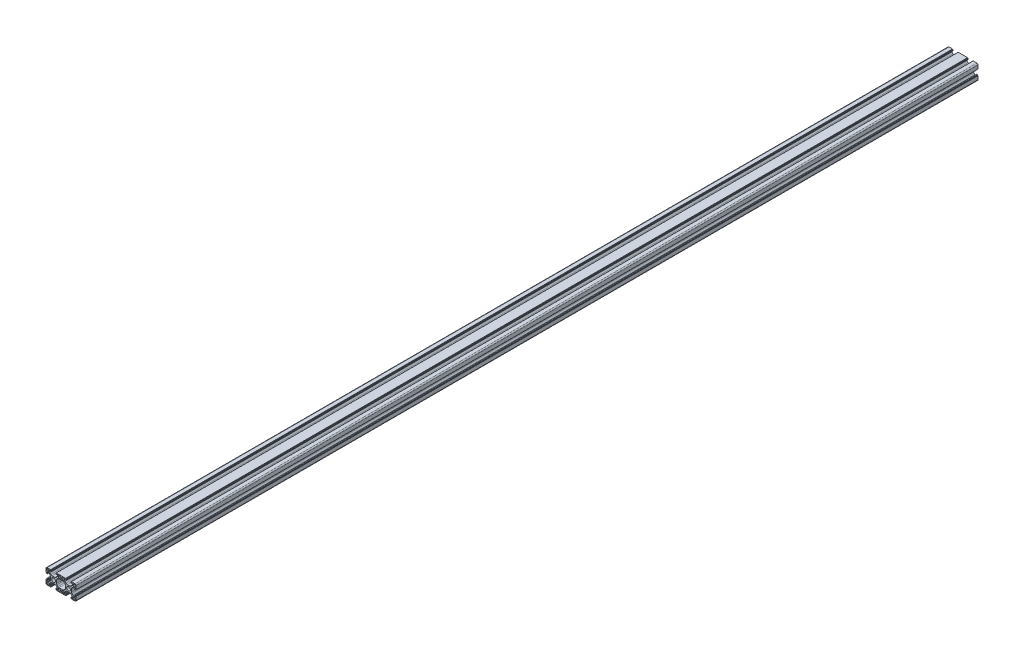
from build123d import *

# Parameters (mm, degrees)
EXTRUDE_1_DEPTH = 1200


with BuildPart() as part:
    # Эскиз2 → Бобышка-Вытянуть1 (new body)
    with BuildSketch(Plane.XY):
        with BuildLine():
            Line((9.107127774, 4.555592697), (11.005908444, 4.555592697))
            ThreePointArc((11.005908444, 4.555592697), (11.771275308, 4.707833632), (12.420122006, 5.141379135))
            Line((12.420122006, 5.141379135), (13.721341337, 6.442598466))
            ThreePointArc((13.721341337, 6.442598466), (14.15488684, 7.091445164), (14.307127774, 7.856812028))
            Line((14.307127774, 7.856812028), (14.307127774, 8.755592697))
            ThreePointArc((14.307127774, 8.755592697), (14.160681165, 9.109146088), (13.807127774, 9.255592697))
            Line((13.807127774, 9.255592697), (13.704234556, 9.255592697))
            ThreePointArc((13.704234556, 9.255592697), (13.51289284, 9.217532464), (13.350681165, 9.109146088))
            Line((13.350681165, 9.109146088), (12.870351079, 8.628816002))
            ThreePointArc((12.870351079, 8.628816002), (12.789245242, 8.574622814), (12.693574384, 8.555592697))
            Line((12.693574384, 8.555592697), (12.407127774, 8.555592697))
            ThreePointArc((12.407127774, 8.555592697), (12.230351079, 8.628816002), (12.157127774, 8.805592697))
            Line((12.157127774, 8.805592697), (12.157127774, 9.954663518))
            ThreePointArc((12.157127774, 9.954663518), (12.201061757, 10.060729535), (12.307127774, 10.104663518))
            Line((12.307127774, 10.104663518), (12.807127774, 10.104663518))
            Line((12.807127774, 10.104663518), (12.807127774, 10.405592697))
            ThreePointArc((12.807127774, 10.405592697), (12.851061757, 10.511658715), (12.957127774, 10.555592697))
            Line((12.957127774, 10.555592697), (17.607127774, 10.555592697))
            ThreePointArc((17.607127774, 10.555592697), (18.667787946, 10.116252869), (19.107127774, 9.055592697))
            Line((19.107127774, 9.055592697), (19.107127774, 4.405592697))
            ThreePointArc((19.107127774, 4.405592697), (19.063193792, 4.29952668), (18.957127774, 4.255592697))
            Line((18.957127774, 4.255592697), (18.656198595, 4.255592697))
            Line((18.656198595, 4.255592697), (18.656198595, 3.755592697))
            ThreePointArc((18.656198595, 3.755592697), (18.612264612, 3.64952668), (18.506198595, 3.605592697))
            Line((18.506198595, 3.605592697), (17.357127774, 3.605592697))
            ThreePointArc((17.357127774, 3.605592697), (17.180351079, 3.678816002), (17.107127774, 3.855592697))
            Line((17.107127774, 3.855592697), (17.107127774, 4.142039307))
            ThreePointArc((17.107127774, 4.142039307), (17.126157891, 4.237710165), (17.180351079, 4.318816002))
            Line((17.180351079, 4.318816002), (17.660681165, 4.799146088))
            ThreePointArc((17.660681165, 4.799146088), (17.769067541, 4.961357762), (17.807127774, 5.152699479))
            Line((17.807127774, 5.152699479), (17.807127774, 5.255592697))
            ThreePointArc((17.807127774, 5.255592697), (17.660681165, 5.609146088), (17.307127774, 5.755592697))
            Line((17.307127774, 5.755592697), (16.408347105, 5.755592697))
            ThreePointArc((16.408347105, 5.755592697), (15.642980241, 5.603351762), (14.994133543, 5.16980626))
            Line((14.994133543, 5.16980626), (13.692914212, 3.868586929))
            ThreePointArc((13.692914212, 3.868586929), (13.259368709, 3.219740231), (13.107127774, 2.454373367))
            Line((13.107127774, 2.454373367), (13.107127774, 0.555592697))
            Line((13.107127774, 0.555592697), (13.107127774, -1.343187972))
            ThreePointArc((13.107127774, -1.343187972), (13.259368709, -2.108554836), (13.692914212, -2.757401534))
            Line((13.692914212, -2.757401534), (14.994133543, -4.058620865))
            ThreePointArc((14.994133543, -4.058620865), (15.642980241, -4.492166368), (16.408347105, -4.644407303))
            Line((16.408347105, -4.644407303), (17.307127774, -4.644407303))
            ThreePointArc((17.307127774, -4.644407303), (17.660681165, -4.497960693), (17.807127774, -4.144407303))
            Line((17.807127774, -4.144407303), (17.807127774, -4.041514084))
            ThreePointArc((17.807127774, -4.041514084), (17.769067541, -3.850172368), (17.660681165, -3.687960693))
            Line((17.660681165, -3.687960693), (17.180351079, -3.207630607))
            ThreePointArc((17.180351079, -3.207630607), (17.126157891, -3.12652477), (17.107127774, -3.030853912))
            Line((17.107127774, -3.030853912), (17.107127774, -2.744407303))
            ThreePointArc((17.107127774, -2.744407303), (17.180351079, -2.567630607), (17.357127774, -2.494407303))
            Line((17.357127774, -2.494407303), (18.506198595, -2.494407303))
            ThreePointArc((18.506198595, -2.494407303), (18.612264612, -2.538341285), (18.656198595, -2.644407303))
            Line((18.656198595, -2.644407303), (18.656198595, -3.144407303))
            Line((18.656198595, -3.144407303), (18.957127774, -3.144407303))
            ThreePointArc((18.957127774, -3.144407303), (19.063193792, -3.188341285), (19.107127774, -3.294407303))
            Line((19.107127774, -3.294407303), (19.107127774, -7.944407303))
            ThreePointArc((19.107127774, -7.944407303), (18.667787946, -9.005067474), (17.607127774, -9.444407303))
            Line((17.607127774, -9.444407303), (12.957127774, -9.444407303))
            ThreePointArc((12.957127774, -9.444407303), (12.851061757, -9.40047332), (12.807127774, -9.294407303))
            Line((12.807127774, -9.294407303), (12.807127774, -8.993478123))
            Line((12.807127774, -8.993478123), (12.307127774, -8.993478123))
            ThreePointArc((12.307127774, -8.993478123), (12.201061757, -8.94954414), (12.157127774, -8.843478123))
            Line((12.157127774, -8.843478123), (12.157127774, -7.694407303))
            ThreePointArc((12.157127774, -7.694407303), (12.230351079, -7.517630607), (12.407127774, -7.444407303))
            Line((12.407127774, -7.444407303), (12.693574384, -7.444407303))
            ThreePointArc((12.693574384, -7.444407303), (12.789245242, -7.463437419), (12.870351079, -7.517630607))
            Line((12.870351079, -7.517630607), (13.350681165, -7.997960693))
            ThreePointArc((13.350681165, -7.997960693), (13.51289284, -8.106347069), (13.704234556, -8.144407303))
            Line((13.704234556, -8.144407303), (13.807127774, -8.144407303))
            ThreePointArc((13.807127774, -8.144407303), (14.160681165, -7.997960693), (14.307127774, -7.644407303))
            Line((14.307127774, -7.644407303), (14.307127774, -6.745626633))
            ThreePointArc((14.307127774, -6.745626633), (14.15488684, -5.980259769), (13.721341337, -5.331413071))
            Line((13.721341337, -5.331413071), (12.420122006, -4.03019374))
            ThreePointArc((12.420122006, -4.03019374), (11.771275308, -3.596648238), (11.005908444, -3.444407303))
            Line((11.005908444, -3.444407303), (9.107127774, -3.444407303))
            Line((9.107127774, -3.444407303), (7.208347105, -3.444407303))
            ThreePointArc((7.208347105, -3.444407303), (6.442980241, -3.596648238), (5.794133543, -4.03019374))
            Line((5.794133543, -4.03019374), (4.492914212, -5.331413071))
            ThreePointArc((4.492914212, -5.331413071), (4.059368709, -5.980259769), (3.907127774, -6.745626633))
            Line((3.907127774, -6.745626633), (3.907127774, -7.644407303))
            ThreePointArc((3.907127774, -7.644407303), (4.053574384, -7.997960693), (4.407127774, -8.144407303))
            Line((4.407127774, -8.144407303), (4.510020993, -8.144407303))
            ThreePointArc((4.510020993, -8.144407303), (4.701362709, -8.106347069), (4.863574384, -7.997960693))
            Line((4.863574384, -7.997960693), (5.34390447, -7.517630607))
            ThreePointArc((5.34390447, -7.517630607), (5.425010307, -7.463437419), (5.520681165, -7.444407303))
            Line((5.520681165, -7.444407303), (5.807127774, -7.444407303))
            ThreePointArc((5.807127774, -7.444407303), (5.98390447, -7.517630607), (6.057127774, -7.694407303))
            Line((6.057127774, -7.694407303), (6.057127774, -8.843478123))
            ThreePointArc((6.057127774, -8.843478123), (6.013193792, -8.94954414), (5.907127774, -8.993478123))
            Line((5.907127774, -8.993478123), (5.407127774, -8.993478123))
            Line((5.407127774, -8.993478123), (5.407127774, -9.294407303))
            ThreePointArc((5.407127774, -9.294407303), (5.363193792, -9.40047332), (5.257127774, -9.444407303))
            Line((5.257127774, -9.444407303), (0.607127774, -9.444407303))
            Line((0.607127774, -9.444407303), (-2.392872226, -9.444407303))
            Line((-2.392872226, -9.444407303), (-7.042872226, -9.444407303))
            ThreePointArc((-7.042872226, -9.444407303), (-7.148938243, -9.40047332), (-7.192872226, -9.294407303))
            Line((-7.192872226, -9.294407303), (-7.192872226, -8.993478123))
            Line((-7.192872226, -8.993478123), (-7.692872226, -8.993478123))
            ThreePointArc((-7.692872226, -8.993478123), (-7.798938243, -8.94954414), (-7.842872226, -8.843478123))
            Line((-7.842872226, -8.843478123), (-7.842872226, -7.694407303))
            ThreePointArc((-7.842872226, -7.694407303), (-7.769648921, -7.517630607), (-7.592872226, -7.444407303))
            Line((-7.592872226, -7.444407303), (-7.306425616, -7.444407303))
            ThreePointArc((-7.306425616, -7.444407303), (-7.210754758, -7.463437419), (-7.129648921, -7.517630607))
            Line((-7.129648921, -7.517630607), (-6.649318835, -7.997960693))
            ThreePointArc((-6.649318835, -7.997960693), (-6.48710716, -8.106347069), (-6.295765444, -8.144407303))
            Line((-6.295765444, -8.144407303), (-6.192872226, -8.144407303))
            ThreePointArc((-6.192872226, -8.144407303), (-5.839318835, -7.997960693), (-5.692872226, -7.644407303))
            Line((-5.692872226, -7.644407303), (-5.692872226, -6.745626633))
            ThreePointArc((-5.692872226, -6.745626633), (-5.84511316, -5.980259769), (-6.278658663, -5.331413071))
            Line((-6.278658663, -5.331413071), (-7.579877994, -4.03019374))
            ThreePointArc((-7.579877994, -4.03019374), (-8.228724692, -3.596648238), (-8.994091556, -3.444407303))
            Line((-8.994091556, -3.444407303), (-10.892872226, -3.444407303))
            Line((-10.892872226, -3.444407303), (-12.791652895, -3.444407303))
            ThreePointArc((-12.791652895, -3.444407303), (-13.557019759, -3.596648238), (-14.205866457, -4.03019374))
            Line((-14.205866457, -4.03019374), (-15.507085788, -5.331413071))
            ThreePointArc((-15.507085788, -5.331413071), (-15.940631291, -5.980259769), (-16.092872226, -6.745626633))
            Line((-16.092872226, -6.745626633), (-16.092872226, -7.644407303))
            ThreePointArc((-16.092872226, -7.644407303), (-15.946425616, -7.997960693), (-15.592872226, -8.144407303))
            Line((-15.592872226, -8.144407303), (-15.489979007, -8.144407303))
            ThreePointArc((-15.489979007, -8.144407303), (-15.298637291, -8.106347069), (-15.136425616, -7.997960693))
            Line((-15.136425616, -7.997960693), (-14.65609553, -7.517630607))
            ThreePointArc((-14.65609553, -7.517630607), (-14.574989693, -7.463437419), (-14.479318835, -7.444407303))
            Line((-14.479318835, -7.444407303), (-14.192872226, -7.444407303))
            ThreePointArc((-14.192872226, -7.444407303), (-14.01609553, -7.517630607), (-13.942872226, -7.694407303))
            Line((-13.942872226, -7.694407303), (-13.942872226, -8.843478123))
            ThreePointArc((-13.942872226, -8.843478123), (-13.986806208, -8.94954414), (-14.092872226, -8.993478123))
            Line((-14.092872226, -8.993478123), (-14.592872226, -8.993478123))
            Line((-14.592872226, -8.993478123), (-14.592872226, -9.294407303))
            ThreePointArc((-14.592872226, -9.294407303), (-14.636806208, -9.40047332), (-14.742872226, -9.444407303))
            Line((-14.742872226, -9.444407303), (-19.392872226, -9.444407303))
            ThreePointArc((-19.392872226, -9.444407303), (-20.453532397, -9.005067474), (-20.892872226, -7.944407303))
            Line((-20.892872226, -7.944407303), (-20.892872226, -3.294407303))
            ThreePointArc((-20.892872226, -3.294407303), (-20.848938243, -3.188341285), (-20.742872226, -3.144407303))
            Line((-20.742872226, -3.144407303), (-20.441943046, -3.144407303))
            Line((-20.441943046, -3.144407303), (-20.441943046, -2.644407303))
            ThreePointArc((-20.441943046, -2.644407303), (-20.398009063, -2.538341285), (-20.291943046, -2.494407303))
            Line((-20.291943046, -2.494407303), (-19.142872226, -2.494407303))
            ThreePointArc((-19.142872226, -2.494407303), (-18.96609553, -2.567630607), (-18.892872226, -2.744407303))
            Line((-18.892872226, -2.744407303), (-18.892872226, -3.030853912))
            ThreePointArc((-18.892872226, -3.030853912), (-18.911902342, -3.12652477), (-18.96609553, -3.207630607))
            Line((-18.96609553, -3.207630607), (-19.446425616, -3.687960693))
            ThreePointArc((-19.446425616, -3.687960693), (-19.554811992, -3.850172368), (-19.592872226, -4.041514084))
            Line((-19.592872226, -4.041514084), (-19.592872226, -4.144407303))
            ThreePointArc((-19.592872226, -4.144407303), (-19.446425616, -4.497960693), (-19.092872226, -4.644407303))
            Line((-19.092872226, -4.644407303), (-18.194091556, -4.644407303))
            ThreePointArc((-18.194091556, -4.644407303), (-17.428724692, -4.492166368), (-16.779877994, -4.058620865))
            Line((-16.779877994, -4.058620865), (-15.478658663, -2.757401534))
            ThreePointArc((-15.478658663, -2.757401534), (-15.04511316, -2.108554836), (-14.892872226, -1.343187972))
            Line((-14.892872226, -1.343187972), (-14.892872226, 0.555592697))
            Line((-14.892872226, 0.555592697), (-14.892872226, 2.454373367))
            ThreePointArc((-14.892872226, 2.454373367), (-15.04511316, 3.219740231), (-15.478658663, 3.868586929))
            Line((-15.478658663, 3.868586929), (-16.779877994, 5.16980626))
            ThreePointArc((-16.779877994, 5.16980626), (-17.428724692, 5.603351762), (-18.194091556, 5.755592697))
            Line((-18.194091556, 5.755592697), (-19.092872226, 5.755592697))
            ThreePointArc((-19.092872226, 5.755592697), (-19.446425616, 5.609146088), (-19.592872226, 5.255592697))
            Line((-19.592872226, 5.255592697), (-19.592872226, 5.152699479))
            ThreePointArc((-19.592872226, 5.152699479), (-19.554811992, 4.961357762), (-19.446425616, 4.799146088))
            Line((-19.446425616, 4.799146088), (-18.96609553, 4.318816002))
            ThreePointArc((-18.96609553, 4.318816002), (-18.911902342, 4.237710165), (-18.892872226, 4.142039307))
            Line((-18.892872226, 4.142039307), (-18.892872226, 3.855592697))
            ThreePointArc((-18.892872226, 3.855592697), (-18.96609553, 3.678816002), (-19.142872226, 3.605592697))
            Line((-19.142872226, 3.605592697), (-20.291943046, 3.605592697))
            ThreePointArc((-20.291943046, 3.605592697), (-20.398009063, 3.64952668), (-20.441943046, 3.755592697))
            Line((-20.441943046, 3.755592697), (-20.441943046, 4.255592697))
            Line((-20.441943046, 4.255592697), (-20.742872226, 4.255592697))
            ThreePointArc((-20.742872226, 4.255592697), (-20.848938243, 4.29952668), (-20.892872226, 4.405592697))
            Line((-20.892872226, 4.405592697), (-20.892872226, 9.055592697))
            ThreePointArc((-20.892872226, 9.055592697), (-20.453532397, 10.116252869), (-19.392872226, 10.555592697))
            Line((-19.392872226, 10.555592697), (-14.742872226, 10.555592697))
            ThreePointArc((-14.742872226, 10.555592697), (-14.636806208, 10.511658715), (-14.592872226, 10.405592697))
            Line((-14.592872226, 10.405592697), (-14.592872226, 10.104663518))
            Line((-14.592872226, 10.104663518), (-14.092872226, 10.104663518))
            ThreePointArc((-14.092872226, 10.104663518), (-13.986806208, 10.060729535), (-13.942872226, 9.954663518))
            Line((-13.942872226, 9.954663518), (-13.942872226, 8.805592697))
            ThreePointArc((-13.942872226, 8.805592697), (-14.01609553, 8.628816002), (-14.192872226, 8.555592697))
            Line((-14.192872226, 8.555592697), (-14.479318835, 8.555592697))
            ThreePointArc((-14.479318835, 8.555592697), (-14.574989693, 8.574622814), (-14.65609553, 8.628816002))
            Line((-14.65609553, 8.628816002), (-15.136425616, 9.109146088))
            ThreePointArc((-15.136425616, 9.109146088), (-15.298637291, 9.217532464), (-15.489979007, 9.255592697))
            Line((-15.489979007, 9.255592697), (-15.592872226, 9.255592697))
            ThreePointArc((-15.592872226, 9.255592697), (-15.946425616, 9.109146088), (-16.092872226, 8.755592697))
            Line((-16.092872226, 8.755592697), (-16.092872226, 7.856812028))
            ThreePointArc((-16.092872226, 7.856812028), (-15.940631291, 7.091445164), (-15.507085788, 6.442598466))
            Line((-15.507085788, 6.442598466), (-14.205866457, 5.141379135))
            ThreePointArc((-14.205866457, 5.141379135), (-13.557019759, 4.707833632), (-12.791652895, 4.555592697))
            Line((-12.791652895, 4.555592697), (-10.892872226, 4.555592697))
            Line((-10.892872226, 4.555592697), (-8.994091556, 4.555592697))
            ThreePointArc((-8.994091556, 4.555592697), (-8.228724692, 4.707833632), (-7.579877994, 5.141379135))
            Line((-7.579877994, 5.141379135), (-6.278658663, 6.442598466))
            ThreePointArc((-6.278658663, 6.442598466), (-5.84511316, 7.091445164), (-5.692872226, 7.856812028))
            Line((-5.692872226, 7.856812028), (-5.692872226, 8.755592697))
            ThreePointArc((-5.692872226, 8.755592697), (-5.839318835, 9.109146088), (-6.192872226, 9.255592697))
            Line((-6.192872226, 9.255592697), (-6.295765444, 9.255592697))
            ThreePointArc((-6.295765444, 9.255592697), (-6.48710716, 9.217532464), (-6.649318835, 9.109146088))
            Line((-6.649318835, 9.109146088), (-7.129648921, 8.628816002))
            ThreePointArc((-7.129648921, 8.628816002), (-7.210754758, 8.574622814), (-7.306425616, 8.555592697))
            Line((-7.306425616, 8.555592697), (-7.592872226, 8.555592697))
            ThreePointArc((-7.592872226, 8.555592697), (-7.769648921, 8.628816002), (-7.842872226, 8.805592697))
            Line((-7.842872226, 8.805592697), (-7.842872226, 9.954663518))
            ThreePointArc((-7.842872226, 9.954663518), (-7.798938243, 10.060729535), (-7.692872226, 10.104663518))
            Line((-7.692872226, 10.104663518), (-7.192872226, 10.104663518))
            Line((-7.192872226, 10.104663518), (-7.192872226, 10.405592697))
            ThreePointArc((-7.192872226, 10.405592697), (-7.148938243, 10.511658715), (-7.042872226, 10.555592697))
            Line((-7.042872226, 10.555592697), (-2.392872226, 10.555592697))
            Line((-2.392872226, 10.555592697), (0.607127774, 10.555592697))
            Line((0.607127774, 10.555592697), (5.257127774, 10.555592697))
            ThreePointArc((5.257127774, 10.555592697), (5.363193792, 10.511658715), (5.407127774, 10.405592697))
            Line((5.407127774, 10.405592697), (5.407127774, 10.104663518))
            Line((5.407127774, 10.104663518), (5.907127774, 10.104663518))
            ThreePointArc((5.907127774, 10.104663518), (6.013193792, 10.060729535), (6.057127774, 9.954663518))
            Line((6.057127774, 9.954663518), (6.057127774, 8.805592697))
            ThreePointArc((6.057127774, 8.805592697), (5.98390447, 8.628816002), (5.807127774, 8.555592697))
            Line((5.807127774, 8.555592697), (5.520681165, 8.555592697))
            ThreePointArc((5.520681165, 8.555592697), (5.425010307, 8.574622814), (5.34390447, 8.628816002))
            Line((5.34390447, 8.628816002), (4.863574384, 9.109146088))
            ThreePointArc((4.863574384, 9.109146088), (4.701362709, 9.217532464), (4.510020993, 9.255592697))
            Line((4.510020993, 9.255592697), (4.407127774, 9.255592697))
            ThreePointArc((4.407127774, 9.255592697), (4.053574384, 9.109146088), (3.907127774, 8.755592697))
            Line((3.907127774, 8.755592697), (3.907127774, 7.856812028))
            ThreePointArc((3.907127774, 7.856812028), (4.059368709, 7.091445164), (4.492914212, 6.442598466))
            Line((4.492914212, 6.442598466), (5.794133543, 5.141379135))
            ThreePointArc((5.794133543, 5.141379135), (6.442980241, 4.707833632), (7.208347105, 4.555592697))
            Line((7.208347105, 4.555592697), (9.107127774, 4.555592697))
        make_face()
        with BuildLine():
            Line((16.007127774, 6.655592697), (17.407127774, 6.655592697))
            ThreePointArc((17.407127774, 6.655592697), (17.972813199, 6.889907273), (18.207127774, 7.455592697))
            Line((18.207127774, 7.455592697), (18.207127774, 8.855592697))
            ThreePointArc((18.207127774, 8.855592697), (17.972813199, 9.421278122), (17.407127774, 9.655592697))
            Line((17.407127774, 9.655592697), (16.007127774, 9.655592697))
            ThreePointArc((16.007127774, 9.655592697), (15.44144235, 9.421278122), (15.207127774, 8.855592697))
            Line((15.207127774, 8.855592697), (15.207127774, 7.455592697))
            ThreePointArc((15.207127774, 7.455592697), (15.44144235, 6.889907273), (16.007127774, 6.655592697))
        make_face(mode=Mode.SUBTRACT)
        with BuildLine():
            Line((15.207127774, -6.344407303), (15.207127774, -7.744407303))
            ThreePointArc((15.207127774, -7.744407303), (15.44144235, -8.310092727), (16.007127774, -8.544407303))
            Line((16.007127774, -8.544407303), (17.407127774, -8.544407303))
            ThreePointArc((17.407127774, -8.544407303), (17.972813199, -8.310092727), (18.207127774, -7.744407303))
            Line((18.207127774, -7.744407303), (18.207127774, -6.344407303))
            ThreePointArc((18.207127774, -6.344407303), (17.972813199, -5.778721878), (17.407127774, -5.544407303))
            Line((17.407127774, -5.544407303), (16.007127774, -5.544407303))
            ThreePointArc((16.007127774, -5.544407303), (15.44144235, -5.778721878), (15.207127774, -6.344407303))
        make_face(mode=Mode.SUBTRACT)
        with BuildLine():
            Line((2.207127774, -5.544407303), (0.807127774, -5.544407303))
            ThreePointArc((0.807127774, -5.544407303), (0.24144235, -5.778721878), (0.007127774, -6.344407303))
            Line((0.007127774, -6.344407303), (0.007127774, -7.744407303))
            ThreePointArc((0.007127774, -7.744407303), (0.24144235, -8.310092727), (0.807127774, -8.544407303))
            Line((0.807127774, -8.544407303), (2.207127774, -8.544407303))
            ThreePointArc((2.207127774, -8.544407303), (2.772813199, -8.310092727), (3.007127774, -7.744407303))
            Line((3.007127774, -7.744407303), (3.007127774, -6.344407303))
            ThreePointArc((3.007127774, -6.344407303), (2.772813199, -5.778721878), (2.207127774, -5.544407303))
        make_face(mode=Mode.SUBTRACT)
        with BuildLine():
            Line((0.907127774, -4.644407303), (1.805908444, -4.644407303))
            ThreePointArc((1.805908444, -4.644407303), (2.571275308, -4.492166368), (3.220122006, -4.058620865))
            Line((3.220122006, -4.058620865), (4.521341337, -2.757401534))
            ThreePointArc((4.521341337, -2.757401534), (4.95488684, -2.108554836), (5.107127774, -1.343187972))
            Line((5.107127774, -1.343187972), (5.107127774, 0.555592697))
            Line((5.107127774, 0.555592697), (5.107127774, 2.454373367))
            ThreePointArc((5.107127774, 2.454373367), (4.95488684, 3.219740231), (4.521341337, 3.868586929))
            Line((4.521341337, 3.868586929), (3.220122006, 5.16980626))
            ThreePointArc((3.220122006, 5.16980626), (2.571275308, 5.603351762), (1.805908444, 5.755592697))
            Line((1.805908444, 5.755592697), (0.907127774, 5.755592697))
            Line((0.907127774, 5.755592697), (-2.692872226, 5.755592697))
            Line((-2.692872226, 5.755592697), (-3.591652895, 5.755592697))
            ThreePointArc((-3.591652895, 5.755592697), (-4.357019759, 5.603351762), (-5.005866457, 5.16980626))
            Line((-5.005866457, 5.16980626), (-6.307085788, 3.868586929))
            ThreePointArc((-6.307085788, 3.868586929), (-6.740631291, 3.219740231), (-6.892872226, 2.454373367))
            Line((-6.892872226, 2.454373367), (-6.892872226, 0.555592697))
            Line((-6.892872226, 0.555592697), (-6.892872226, -1.343187972))
            ThreePointArc((-6.892872226, -1.343187972), (-6.740631291, -2.108554836), (-6.307085788, -2.757401534))
            Line((-6.307085788, -2.757401534), (-5.005866457, -4.058620865))
            ThreePointArc((-5.005866457, -4.058620865), (-4.357019759, -4.492166368), (-3.591652895, -4.644407303))
            Line((-3.591652895, -4.644407303), (-2.692872226, -4.644407303))
            Line((-2.692872226, -4.644407303), (0.907127774, -4.644407303))
        make_face(mode=Mode.SUBTRACT)
        with BuildLine():
            Line((3.007127774, 7.455592697), (3.007127774, 8.855592697))
            ThreePointArc((3.007127774, 8.855592697), (2.772813199, 9.421278122), (2.207127774, 9.655592697))
            Line((2.207127774, 9.655592697), (0.807127774, 9.655592697))
            ThreePointArc((0.807127774, 9.655592697), (0.24144235, 9.421278122), (0.007127774, 8.855592697))
            Line((0.007127774, 8.855592697), (0.007127774, 7.455592697))
            ThreePointArc((0.007127774, 7.455592697), (0.24144235, 6.889907273), (0.807127774, 6.655592697))
            Line((0.807127774, 6.655592697), (2.207127774, 6.655592697))
            ThreePointArc((2.207127774, 6.655592697), (2.772813199, 6.889907273), (3.007127774, 7.455592697))
        make_face(mode=Mode.SUBTRACT)
        with BuildLine():
            Line((-2.592872226, 9.655592697), (-3.992872226, 9.655592697))
            ThreePointArc((-3.992872226, 9.655592697), (-4.55855765, 9.421278122), (-4.792872226, 8.855592697))
            Line((-4.792872226, 8.855592697), (-4.792872226, 7.455592697))
            ThreePointArc((-4.792872226, 7.455592697), (-4.55855765, 6.889907273), (-3.992872226, 6.655592697))
            Line((-3.992872226, 6.655592697), (-2.592872226, 6.655592697))
            ThreePointArc((-2.592872226, 6.655592697), (-2.027186801, 6.889907273), (-1.792872226, 7.455592697))
            Line((-1.792872226, 7.455592697), (-1.792872226, 8.855592697))
            ThreePointArc((-1.792872226, 8.855592697), (-2.027186801, 9.421278122), (-2.592872226, 9.655592697))
        make_face(mode=Mode.SUBTRACT)
        with BuildLine():
            Line((-1.792872226, -7.744407303), (-1.792872226, -6.344407303))
            ThreePointArc((-1.792872226, -6.344407303), (-2.027186801, -5.778721878), (-2.592872226, -5.544407303))
            Line((-2.592872226, -5.544407303), (-3.992872226, -5.544407303))
            ThreePointArc((-3.992872226, -5.544407303), (-4.55855765, -5.778721878), (-4.792872226, -6.344407303))
            Line((-4.792872226, -6.344407303), (-4.792872226, -7.744407303))
            ThreePointArc((-4.792872226, -7.744407303), (-4.55855765, -8.310092727), (-3.992872226, -8.544407303))
            Line((-3.992872226, -8.544407303), (-2.592872226, -8.544407303))
            ThreePointArc((-2.592872226, -8.544407303), (-2.027186801, -8.310092727), (-1.792872226, -7.744407303))
        make_face(mode=Mode.SUBTRACT)
        with BuildLine():
            Line((-19.192872226, -8.544407303), (-17.792872226, -8.544407303))
            ThreePointArc((-17.792872226, -8.544407303), (-17.227186801, -8.310092727), (-16.992872226, -7.744407303))
            Line((-16.992872226, -7.744407303), (-16.992872226, -6.344407303))
            ThreePointArc((-16.992872226, -6.344407303), (-17.227186801, -5.778721878), (-17.792872226, -5.544407303))
            Line((-17.792872226, -5.544407303), (-19.192872226, -5.544407303))
            ThreePointArc((-19.192872226, -5.544407303), (-19.75855765, -5.778721878), (-19.992872226, -6.344407303))
            Line((-19.992872226, -6.344407303), (-19.992872226, -7.744407303))
            ThreePointArc((-19.992872226, -7.744407303), (-19.75855765, -8.310092727), (-19.192872226, -8.544407303))
        make_face(mode=Mode.SUBTRACT)
        with BuildLine():
            Line((-19.992872226, 8.855592697), (-19.992872226, 7.455592697))
            ThreePointArc((-19.992872226, 7.455592697), (-19.75855765, 6.889907273), (-19.192872226, 6.655592697))
            Line((-19.192872226, 6.655592697), (-17.792872226, 6.655592697))
            ThreePointArc((-17.792872226, 6.655592697), (-17.227186801, 6.889907273), (-16.992872226, 7.455592697))
            Line((-16.992872226, 7.455592697), (-16.992872226, 8.855592697))
            ThreePointArc((-16.992872226, 8.855592697), (-17.227186801, 9.421278122), (-17.792872226, 9.655592697))
            Line((-17.792872226, 9.655592697), (-19.192872226, 9.655592697))
            ThreePointArc((-19.192872226, 9.655592697), (-19.75855765, 9.421278122), (-19.992872226, 8.855592697))
        make_face(mode=Mode.SUBTRACT)
        with BuildLine():
            ThreePointArc((11.607127774, 0.555592697), (10.874894727, 2.32335965), (9.107127774, 3.055592697))
            ThreePointArc((9.107127774, 3.055592697), (7.339360822, 2.32335965), (6.607127774, 0.555592697))
            ThreePointArc((6.607127774, 0.555592697), (7.339360822, -1.212174255), (9.107127774, -1.944407303))
            ThreePointArc((9.107127774, -1.944407303), (10.874894727, -1.212174255), (11.607127774, 0.555592697))
        make_face(mode=Mode.SUBTRACT)
        with BuildLine():
            ThreePointArc((-10.892872226, 3.055592697), (-9.125105273, 2.32335965), (-8.392872226, 0.555592697))
            ThreePointArc((-8.392872226, 0.555592697), (-9.125105273, -1.212174255), (-10.892872226, -1.944407303))
            ThreePointArc((-10.892872226, -1.944407303), (-12.660639178, -1.212174255), (-13.392872226, 0.555592697))
            ThreePointArc((-13.392872226, 0.555592697), (-12.660639178, 2.32335965), (-10.892872226, 3.055592697))
        make_face(mode=Mode.SUBTRACT)
    extrude(amount=EXTRUDE_1_DEPTH)


solid = part.part
